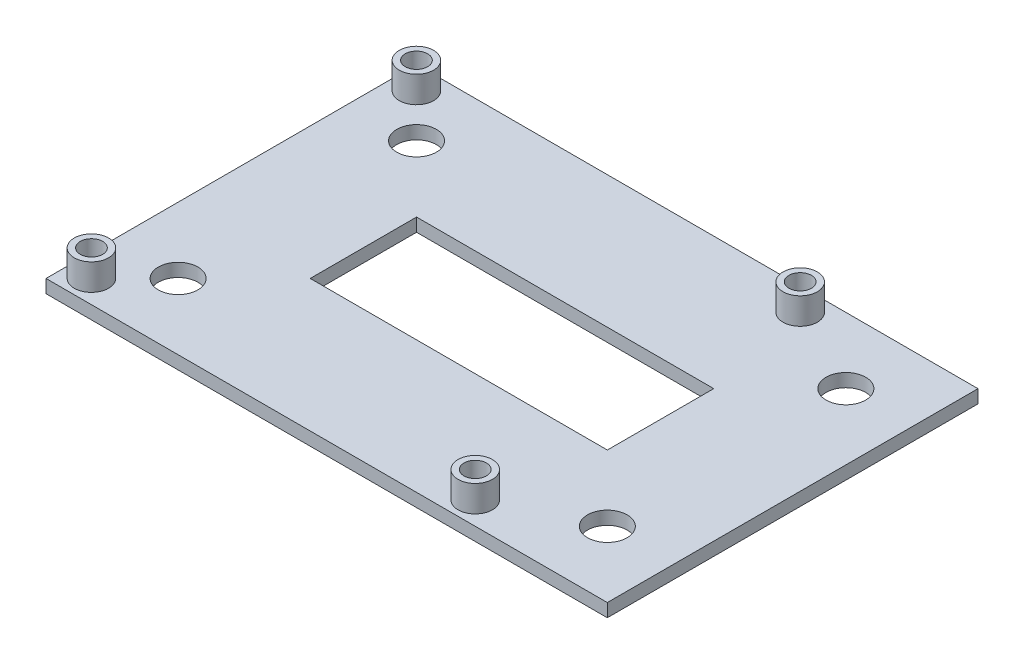
from build123d import *

# Parameters (mm, degrees)
BOSS_EXTRUDE1_DEPTH     = 2
CUT_EXTRUDE2_DEPTH      = 2
WALL_MOUNT_HOLES_R      = 3
CUT_EXTRUDE3_DEPTH      = 2
STANDOFF_MOUNTS_R       = 2.6
BOSS_EXTRUDE3_DEPTH     = 4
ODROID_C1_MOUNT_HOLES_R = 1.7
CUT_EXTRUDE4_DEPTH      = 6


with BuildPart() as part:
    # Base plate → Boss-Extrude1 (new body)
    with BuildSketch(Plane(origin=(0, 0, 0), x_dir=(1, 0, 0), z_dir=(0, 1, 0))):
        Polygon((-13.872098625, 23.726545041), (71.127901375, 23.726545041), (71.10965601, -32.373454959), (-13.872098625, -32.373454959), align=None)
    extrude(amount=BOSS_EXTRUDE1_DEPTH)

    # Base Plate Hole → Cut-Extrude2 (cut)
    with BuildSketch(Plane(origin=(0, 0, 0), x_dir=(1, 0, 0), z_dir=(0, 1, 0))):
        Polygon((6.127901375, 3.726545041), (51.121395731, 3.726545041), (51.116159539, -12.373454959), (6.127901375, -12.373454959), align=None)
    extrude(amount=CUT_EXTRUDE2_DEPTH, mode=Mode.SUBTRACT)

    # Wall Mount Holes → Cut-Extrude3 (cut)
    with BuildSketch(Plane(origin=(0, 0, 0), x_dir=(1, 0, 0), z_dir=(0, 1, 0))):
        with Locations(Location((-3.872098625, 13.726545041, 0), (0, 0, 270))):
            Circle(WALL_MOUNT_HOLES_R)
        with Locations(Location((-3.872098625, -22.373454959, 0), (0, 0, 270))):
            Circle(WALL_MOUNT_HOLES_R)
        with Locations(Location((61.124648553, 13.726545041, 0), (0, 0, 270))):
            Circle(WALL_MOUNT_HOLES_R)
        with Locations(Location((61.112907774, -22.373454959, 0), (0, 0, 270))):
            Circle(WALL_MOUNT_HOLES_R)
    extrude(amount=CUT_EXTRUDE3_DEPTH, mode=Mode.SUBTRACT)

    # Standoff Mounts → Boss-Extrude3 (add)
    with BuildSketch(Plane(origin=(0, 2, 0), x_dir=(1, 0, 0), z_dir=(0, 1, 0))):
        with Locations(Location((-10.44034399, 20.276545041, 0), (0, 0, 270))):
            Circle(STANDOFF_MOUNTS_R)
        with Locations(Location((47.65965601, 20.276545041, 0), (0, 0, 270))):
            Circle(STANDOFF_MOUNTS_R)
        with Locations(Location((-10.44034399, -28.923454959, 0), (0, 0, 270))):
            Circle(STANDOFF_MOUNTS_R)
        with Locations(Location((47.65965601, -28.923454959, 0), (0, 0, 270))):
            Circle(STANDOFF_MOUNTS_R)
    extrude(amount=BOSS_EXTRUDE3_DEPTH)

    # Odroid C1 Mount Holes → Cut-Extrude4 (cut)
    with BuildSketch(Plane(origin=(0, 6, 0), x_dir=(1, 0, 0), z_dir=(0, 1, 0))):
        with Locations(Location((-10.44034399, -28.923454959, 0), (0, 0, 270))):
            Circle(ODROID_C1_MOUNT_HOLES_R)
        with Locations(Location((-10.44034399, 20.276545041, 0), (0, 0, 270))):
            Circle(ODROID_C1_MOUNT_HOLES_R)
        with Locations(Location((47.65965601, 20.276545041, 0), (0, 0, 270))):
            Circle(ODROID_C1_MOUNT_HOLES_R)
        with Locations(Location((47.65965601, -28.923454959, 0), (0, 0, 270))):
            Circle(ODROID_C1_MOUNT_HOLES_R)
    extrude(amount=-CUT_EXTRUDE4_DEPTH, mode=Mode.SUBTRACT)


solid = part.part
